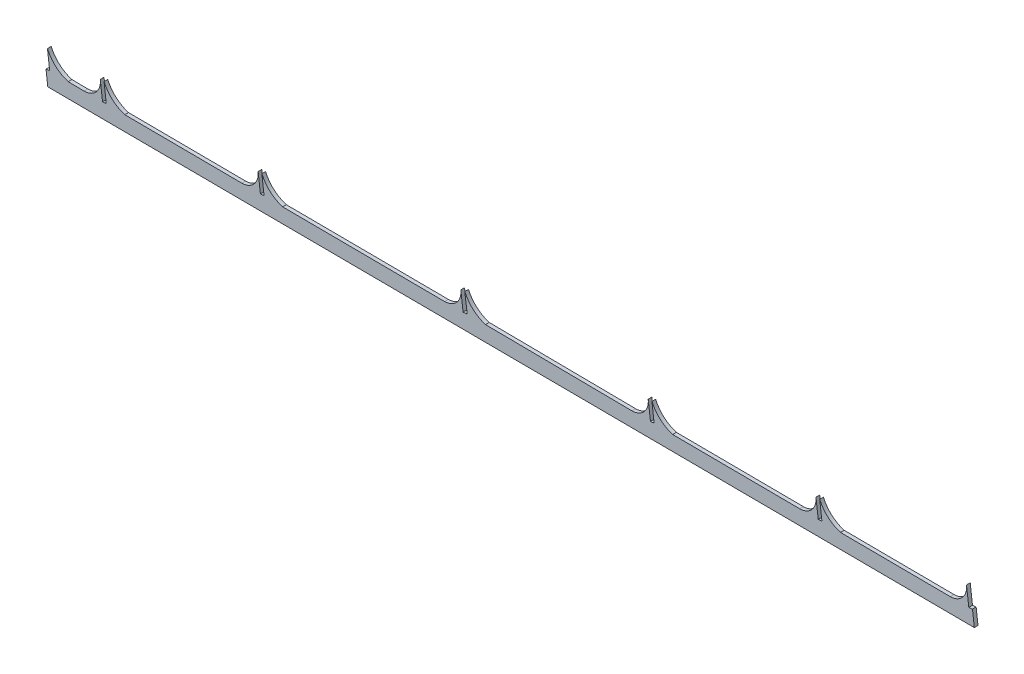
from build123d import *

# Parameters (mm, degrees)
EXTRUDE_1_DEPTH = 2


with BuildPart() as part:
    # Model → 凸台-拉伸1 (new body)
    with BuildSketch(Plane.XY):
        with BuildLine():
            Line((-35.311080617, 12.168656155), (465.757096498, 9.433834614))
            Line((465.757096498, 9.433834614), (464.752347114, 17.616861673))
            Line((464.752347114, 17.616861673), (462.76725481, 17.373122986))
            Line((462.76725481, 17.373122986), (461.547077382, 27.310670661))
            ThreePointArc((461.547077382, 27.310670661), (459.358669596, 20.416173483), (452.765919761, 17.439788161))
            Line((452.765919761, 17.439788161), (393.370792837, 17.835693957))
            ThreePointArc((393.370792837, 17.835693957), (386.669478588, 21.553462885), (382.152114107, 27.744007013))
            Line((382.152114107, 27.744007013), (383.335527601, 18.105877549))
            Line((383.335527601, 18.105877549), (381.350435298, 17.862138863))
            Line((381.350435298, 17.862138863), (380.135743173, 27.755012331))
            ThreePointArc((380.135743173, 27.755012331), (377.947335387, 20.860515153), (371.354585551, 17.884129831))
            Line((371.354585551, 17.884129831), (302.634100804, 18.330933271))
            ThreePointArc((302.634100804, 18.330933271), (295.932786555, 22.048702198), (291.415422074, 28.239246326))
            Line((291.415422074, 28.239246326), (292.594356772, 18.637593727))
            Line((292.594356772, 18.637593727), (290.609264469, 18.39385504))
            Line((290.609264469, 18.39385504), (289.39905114, 28.250251644))
            ThreePointArc((289.39905114, 28.250251644), (287.210643354, 21.355754466), (280.617893518, 18.379369144))
            Line((280.617893518, 18.379369144), (201.427401733, 19.185275472))
            ThreePointArc((201.427401733, 19.185275472), (194.726087484, 22.903044399), (190.208723003, 29.093588528))
            Line((190.208723003, 29.093588528), (191.522738388, 19.198231962))
            Line((191.522738388, 19.198231962), (189.289509547, 18.924025939))
            Line((189.289509547, 18.924025939), (188.076491094, 28.803268444))
            ThreePointArc((188.076491094, 28.803268444), (185.888083308, 21.908771266), (179.295333472, 18.932385944))
            Line((179.295333472, 18.932385944), (91.685409222, 19.482287621))
            ThreePointArc((91.685409222, 19.482287621), (84.984094973, 23.200056549), (80.466730491, 29.390600677))
            Line((80.466730491, 29.390600677), (81.651505322, 19.741384012))
            Line((81.651505322, 19.741384012), (79.666413019, 19.497645325))
            Line((79.666413019, 19.497645325), (78.450359557, 29.401605995))
            ThreePointArc((78.450359557, 29.401605995), (76.261951771, 22.507108817), (69.669201936, 19.530723495))
            Line((69.669201936, 19.530723495), (6.328074304, 19.948166495))
            ThreePointArc((6.328074304, 19.948166495), (-0.373239945, 23.665935423), (-4.890604427, 29.856479551))
            Line((-4.890604427, 29.856479551), (-3.70346647, 20.188016775))
            Line((-3.70346647, 20.188016775), (-5.688558774, 19.944278089))
            Line((-5.688558774, 19.944278089), (-6.906975361, 29.867484869))
            ThreePointArc((-6.906975361, 29.867484869), (-9.095383147, 22.972987691), (-15.688132982, 19.996602369))
            Line((-15.688132982, 19.996602369), (-24.269679134, 20.11516851))
            ThreePointArc((-24.269679134, 20.11516851), (-30.970993383, 23.832937438), (-35.488357864, 30.023481566))
            Line((-35.488357864, 30.023481566), (-34.288766793, 20.253596312))
            Line((-34.288766793, 20.253596312), (-36.273859097, 20.009857625))
            Line((-36.273859097, 20.009857625), (-35.311080617, 12.168656155))
        make_face()
    extrude(amount=EXTRUDE_1_DEPTH)


solid = part.part
